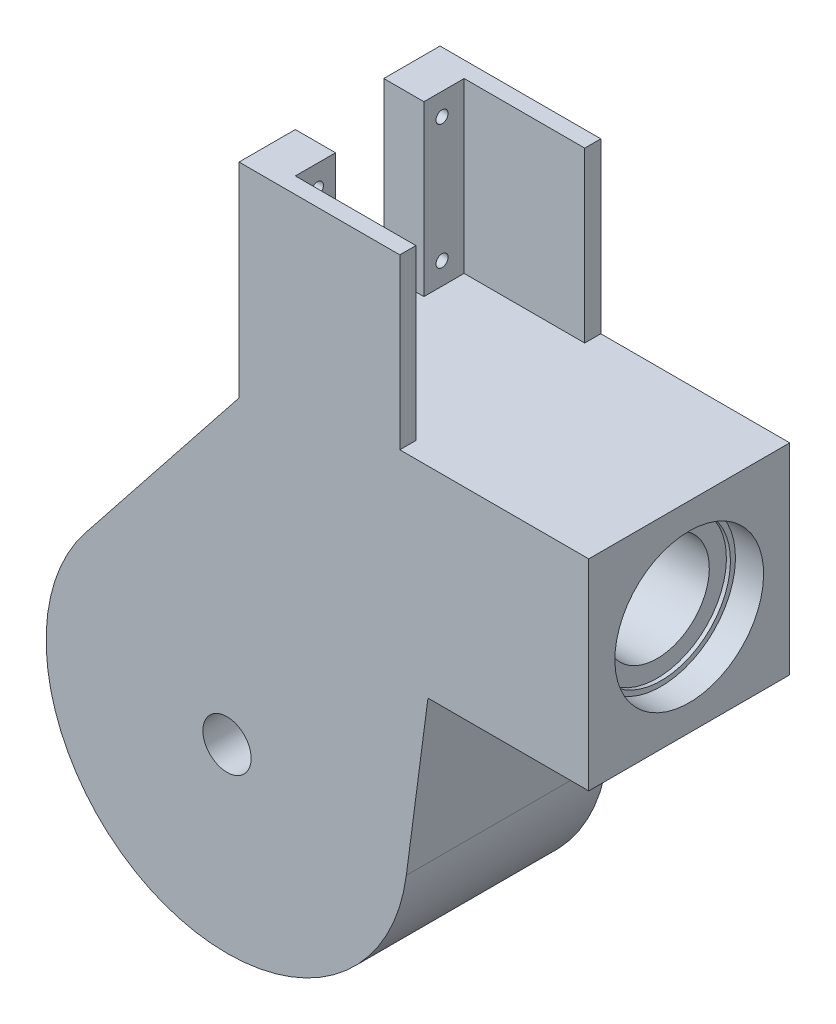
from build123d import *

# Parameters (mm, degrees)
SKETCH1_W                       = 40
SKETCH1_H                       = 50
SKETCH1_R                       = 45
BOSS_EXTRUDE1_DEPTH             = 50
SKETCH3_R                       = 13
CUT_EXTRUDE1_DEPTH              = 130
BOSS_EXTRUDE3_DEPTH             = 42
BOSS_EXTRUDE3_DEPTH_BACK        = 10
SKETCH6_W                       = 7
SKETCH6_H                       = 4
SKETCH6_H_2                     = 10
SKETCH6_W_2                     = 3
CUT_EXTRUDE2_DEPTH              = 11
CUT_EXTRUDE2_DEPTH_BACK         = 43
SKETCH5_W                       = 42
SKETCH5_H                       = 40
SKETCH9_R                       = 1.5
CUT_EXTRUDE4_DEPTH              = 10
SKIZZE1_R                       = 6
SCHNITT_LINEAR_AUSTRAGEN1_DEPTH = 50
AUFSATZ_LINEAR_START            = 36
SKIZZE2_R                       = 17.5
SKIZZE2_R_2                     = 6
AUFSATZ_LINEAR_AUSTRAGEN1_DEPTH = 36
AUFSATZ_LINEAR_START_2          = 1
SKIZZE3_R                       = 21.5
SKIZZE3_R_2                     = 17.5
AUFSATZ_LINEAR_AUSTRAGEN2_DEPTH = 1
SKIZZE4_R                       = 1.65
SCHNITT_LINEAR_AUSTRAGEN2_DEPTH = 15
SKIZZE5_R                       = 18.5
SCHNITT_LINEAR_AUSTRAGEN3_DEPTH = 7
SKIZZE6_R                       = 17.25
SCHNITT_LINEAR_AUSTRAGEN4_DEPTH = 1


with BuildPart() as part:
    # Sketch1 → Boss-Extrude1 (new body)
    with BuildSketch(Plane.XY):
        with Locations((70, 60)):
            Rectangle(SKETCH1_W, SKETCH1_H)
        with BuildLine():
            Line((44.614473451, -5.877819215), (50, 35))
            Line((50, 35), (50, 85))
            Line((50, 85), (10, 85))
            Line((10, 85), (-35.25108577, 27.970715973))
            ThreePointArc((-35.25108577, 27.970715973), (14.810488519, 42.492933881), (45, 0))
            ThreePointArc((45, 0), (44.903514925, -2.945224501), (44.614473451, -5.877819215))
        make_face()
        Circle(SKETCH1_R)
    extrude(amount=BOSS_EXTRUDE1_DEPTH)

    # Sketch3 → Cut-Extrude1 (cut)
    with BuildSketch(Plane(origin=(90, 0, 0), x_dir=(0, 0, -1), z_dir=(1, 0, 0))):
        with Locations(Location((-25, 60, 0), (0, 0, 90))):
            Circle(SKETCH3_R)
    extrude(amount=-CUT_EXTRUDE1_DEPTH, mode=Mode.SUBTRACT)

    # Sketch6 → Boss-Extrude3 (add, two sides: drawn at the far end of the back side and taken through both)
    with BuildSketch(Plane(origin=(0, 85, 0), x_dir=(1, 0, 0), z_dir=(0, 1, 0)).offset(-BOSS_EXTRUDE3_DEPTH_BACK)):
        Polygon((43, -4), (43, 0), (10, 0), (10, -4), (13, -4), align=None)
        with Locations((6.5, -2)):
            Rectangle(SKETCH6_W, SKETCH6_H)
        with Locations((6.5, -9)):
            Rectangle(SKETCH6_W, SKETCH6_H_2)
        with Locations((11.5, -9)):
            Rectangle(SKETCH6_W_2, SKETCH6_H_2)
        with Locations((11.5, -41)):
            Rectangle(SKETCH6_W_2, SKETCH6_H_2)
        with Locations((6.5, -41)):
            Rectangle(SKETCH6_W, SKETCH6_H_2)
        with Locations((6.5, -48)):
            Rectangle(SKETCH6_W, SKETCH6_H)
        Polygon((13, -46), (10, -46), (10, -50), (43, -50), (43, -46), align=None)
    extrude(amount=BOSS_EXTRUDE3_DEPTH + BOSS_EXTRUDE3_DEPTH_BACK)

    # Sketch5 → Cut-Extrude2 (cut, two sides: drawn at the far end of the back side and taken through both)
    with BuildSketch(Plane.ZY.offset(40).offset(-CUT_EXTRUDE2_DEPTH_BACK)):
        with Locations((25, 60)):
            Rectangle(SKETCH5_W, SKETCH5_H)
    extrude(amount=CUT_EXTRUDE2_DEPTH + CUT_EXTRUDE2_DEPTH_BACK, mode=Mode.SUBTRACT)

    # Sketch9 → Cut-Extrude4 (cut)
    with BuildSketch(Plane(origin=(13, 0, 0), x_dir=(0, 0, -1), z_dir=(1, 0, 0))):
        with Locations(Location((-9.500219356, 121.499780644, 0), (0, 0, 90))):
            Circle(SKETCH9_R)
        with Locations(Location((-9.500219356, 90.500219356, 0), (0, 0, 90))):
            Circle(SKETCH9_R)
        with Locations(Location((-40.499780644, 90.500219356, 0), (0, 0, 90))):
            Circle(SKETCH9_R)
        with Locations(Location((-40.499780644, 121.499780644, 0), (0, 0, 90))):
            Circle(SKETCH9_R)
    extrude(amount=-CUT_EXTRUDE4_DEPTH, mode=Mode.SUBTRACT)

    # Skizze1 → Schnitt-Linear austragen1 (cut)
    with BuildSketch(Plane(origin=(0, 0, 0), x_dir=(-1, 0, 0), z_dir=(0, 0, -1))):
        Circle(SKIZZE1_R)
    extrude(amount=-SCHNITT_LINEAR_AUSTRAGEN1_DEPTH, mode=Mode.SUBTRACT)

    # Skizze2 → Aufsatz-Linear austragen1 (add)
    with BuildSketch(Plane(origin=(0, 0, 0), x_dir=(-1, 0, 0), z_dir=(0, 0, -1)).offset(AUFSATZ_LINEAR_START)):
        with Locations(Location((0, 0, 0), (0, 0, 180))):
            Circle(SKIZZE2_R)
        Circle(SKIZZE2_R_2, mode=Mode.SUBTRACT)
    extrude(amount=-AUFSATZ_LINEAR_AUSTRAGEN1_DEPTH)

    # Skizze3 → Aufsatz-Linear austragen2 (add)
    with BuildSketch(Plane(origin=(0, 0, 0), x_dir=(-1, 0, 0), z_dir=(0, 0, -1)).offset(AUFSATZ_LINEAR_START_2)):
        with Locations(Location((0, 0, 0), (0, 0, 180))):
            Circle(SKIZZE3_R)
        Circle(SKIZZE3_R_2, mode=Mode.SUBTRACT)
    extrude(amount=-AUFSATZ_LINEAR_AUSTRAGEN2_DEPTH)

    # Skizze4 → Schnitt-Linear austragen2 (cut)
    with BuildSketch(Plane(origin=(0, 0, -36), x_dir=(-1, 0, 0), z_dir=(0, 0, -1))):
        with Locations((-11.75, 0)):
            Circle(SKIZZE4_R)
        with Locations((-5.875, 10.175798494)):
            Circle(SKIZZE4_R)
        with Locations((5.875, 10.175798494)):
            Circle(SKIZZE4_R)
        with Locations((11.75, 0)):
            Circle(SKIZZE4_R)
        with Locations((5.875, -10.175798494)):
            Circle(SKIZZE4_R)
        with Locations((-5.875, -10.175798494)):
            Circle(SKIZZE4_R)
    extrude(amount=-SCHNITT_LINEAR_AUSTRAGEN2_DEPTH, mode=Mode.SUBTRACT)

    # Skizze5 → Schnitt-Linear austragen3 (cut)
    with BuildSketch(Plane(origin=(90, 0, 0), x_dir=(0, 0, -1), z_dir=(1, 0, 0))):
        with Locations(Location((-25, 60, 0), (0, 0, 90))):
            Circle(SKIZZE5_R)
    schnitt_linear_austragen3 = extrude(amount=-SCHNITT_LINEAR_AUSTRAGEN3_DEPTH, mode=Mode.SUBTRACT)

    # Skizze6 → Schnitt-Linear austragen4 (cut)
    with BuildSketch(Plane(origin=(83, 0, 0), x_dir=(0, 0, -1), z_dir=(1, 0, 0))):
        with Locations(Location((-25, 60, 0), (0, 0, 90))):
            Circle(SKIZZE6_R)
    schnitt_linear_austragen4 = extrude(amount=-SCHNITT_LINEAR_AUSTRAGEN4_DEPTH, mode=Mode.SUBTRACT)

    # Spiegeln1: Schnitt-Linear austragen3, Schnitt-Linear austragen4 across plane
    add(schnitt_linear_austragen3.mirror(Plane(origin=(46.5, 0, 0), x_dir=(0, 0, 1), z_dir=(1, 0, 0))), mode=Mode.SUBTRACT)
    add(schnitt_linear_austragen4.mirror(Plane(origin=(46.5, 0, 0), x_dir=(0, 0, 1), z_dir=(1, 0, 0))), mode=Mode.SUBTRACT)


solid = part.part
